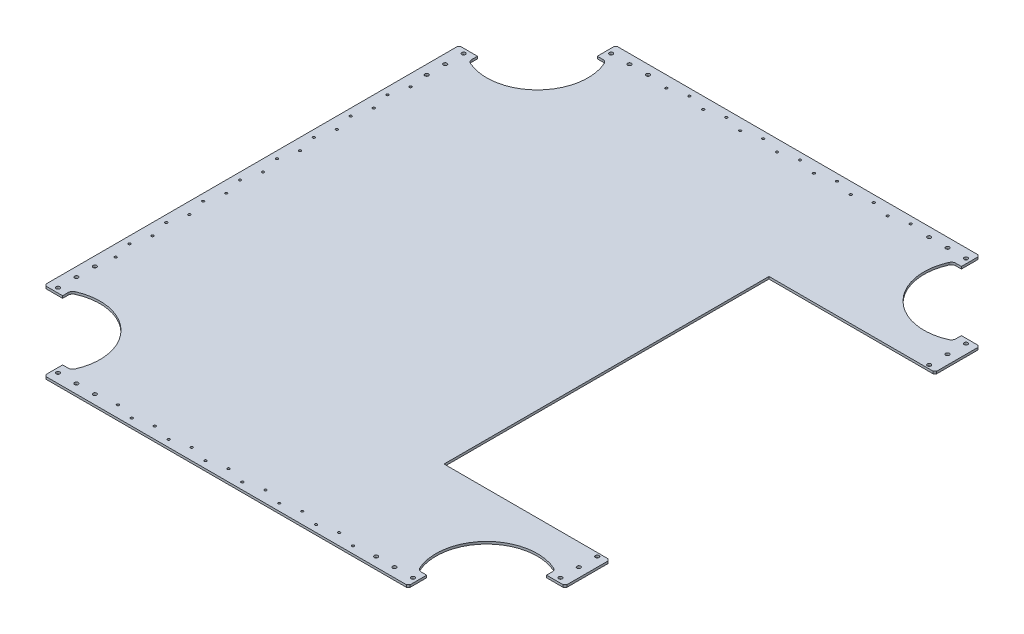
from build123d import *

# Parameters (mm, degrees)
SKETCH1_W                    = 717.55
SKETCH1_H                    = 787.4
BOSS_EXTRUDE1_DEPTH          = 3.175
SWERVE_CUTOUT_DEPTH          = 533.662436492
SKETCH2_W                    = 228.6
SKETCH2_H                    = 447.675
INTAKE_CUTOUT_DEPTH          = 3.175
F_8_0_199_DIAMETER_HOLE1_D   = 5.0546
F_30_0_1285_DIAMETER_HOLE1_D = 3.2639
FILLET1_R                    = 6.35
CHAMFER1_SIZE                = 2.54


with BuildPart() as part:
    # Sketch1 → Boss-Extrude1 (new body)
    with BuildSketch(Plane(origin=(0, 0, 0), x_dir=(1, 0, 0), z_dir=(0, 1, 0))):
        Rectangle(SKETCH1_W, SKETCH1_H)
    extrude(amount=BOSS_EXTRUDE1_DEPTH)

    # Sketch8 → Swerve Cutout (cut, through all)
    with BuildSketch(Plane(origin=(0, 3.175, 0), x_dir=(1, 0, 0), z_dir=(0, 1, 0))):
        with BuildLine():
            Line((358.775, 285.755663772), (358.775, 393.7))
            Line((358.775, 393.7), (250.830663772, 393.7))
            Line((250.830663772, 393.7), (250.830663772, 368.3))
            Line((250.830663772, 368.3), (239.222863772, 368.3))
            ThreePointArc((239.222863772, 368.3), (251.852591334, 286.777591334), (333.375, 274.147863772))
            Line((333.375, 274.147863772), (333.375, 285.755663772))
            Line((333.375, 285.755663772), (358.775, 285.755663772))
        make_face()
        with BuildLine():
            Line((333.375, -285.755663772), (333.375, -274.147863772))
            ThreePointArc((333.375, -274.147863772), (251.852591334, -286.777591334), (239.222863772, -368.3))
            Line((239.222863772, -368.3), (250.830663772, -368.3))
            Line((250.830663772, -368.3), (250.830663772, -393.7))
            Line((250.830663772, -393.7), (358.775, -393.7))
            Line((358.775, -393.7), (358.775, -285.755663772))
            Line((358.775, -285.755663772), (333.375, -285.755663772))
        make_face()
        with BuildLine():
            Line((-358.775, -285.755663772), (-358.775, -393.7))
            Line((-358.775, -393.7), (-250.830663772, -393.7))
            Line((-250.830663772, -393.7), (-250.830663772, -368.3))
            Line((-250.830663772, -368.3), (-239.222863772, -368.3))
            ThreePointArc((-239.222863772, -368.3), (-251.852591334, -286.777591334), (-333.375, -274.147863772))
            Line((-333.375, -274.147863772), (-333.375, -285.755663772))
            Line((-333.375, -285.755663772), (-358.775, -285.755663772))
        make_face()
        with BuildLine():
            Line((-333.375, 285.755663772), (-333.375, 274.147863772))
            ThreePointArc((-333.375, 274.147863772), (-251.852591334, 286.777591334), (-239.222863772, 368.3))
            Line((-239.222863772, 368.3), (-250.830663772, 368.3))
            Line((-250.830663772, 368.3), (-250.830663772, 393.7))
            Line((-250.830663772, 393.7), (-358.775, 393.7))
            Line((-358.775, 393.7), (-358.775, 285.755663772))
            Line((-358.775, 285.755663772), (-333.375, 285.755663772))
        make_face()
    extrude(amount=-SWERVE_CUTOUT_DEPTH, mode=Mode.SUBTRACT)

    # Sketch2 → Intake Cutout (cut)
    with BuildSketch(Plane(origin=(0, 3.175, 0), x_dir=(1, 0, 0), z_dir=(0, 1, 0))):
        with Locations((244.475, 0)):
            Rectangle(SKETCH2_W, SKETCH2_H)
    extrude(amount=-INTAKE_CUTOUT_DEPTH, mode=Mode.SUBTRACT)

    # #8 (0.199) Diameter Hole1 (through all)
    with Locations(Plane(origin=(0, 3.175, 0), x_dir=(1, 0, 0), z_dir=(0, 1, 0))):
        with Locations((244.480663772, 381), (219.080663772, 381), (193.680663772, 381), (346.075, 279.405663772), (346.075, 254.005663772), (346.075, 228.605663772), (346.075, -228.605663772), (346.075, -254.005663772), (346.075, -279.405663772), (193.680663772, -381), (219.080663772, -381), (244.480663772, -381), (-244.480663772, -381), (-219.080663772, -381), (-193.680663772, -381), (-346.075, -279.405663772), (-346.075, -254.005663772), (-346.075, -228.605663772), (-346.075, 228.605663772), (-346.075, 254.005663772), (-346.075, 279.405663772), (-193.680663772, 381), (-219.080663772, 381), (-244.480663772, 381)):
            Hole(F_8_0_199_DIAMETER_HOLE1_D / 2)

    # #30 (0.1285) Diameter Hole1 (through all)
    with Locations(Plane(origin=(0, 3.175, 0), x_dir=(1, 0, 0), z_dir=(0, 1, 0))):
        with Locations((-139.7, 384.175), (-114.3, 377.825), (-88.9, 384.175), (-63.5, 377.825), (-38.1, 384.175), (-12.7, 377.825), (12.7, 384.175), (38.1, 377.825), (63.5, 384.175), (88.9, 377.825), (114.3, 384.175), (139.7, 377.825), (165.1, 384.175), (-165.1, 377.825), (-165.1, -377.825), (165.1, -384.175), (139.7, -377.825), (114.3, -384.175), (88.9, -377.825), (63.5, -384.175), (38.1, -377.825), (12.7, -384.175), (-12.7, -377.825), (-38.1, -384.175), (-63.5, -377.825), (-88.9, -384.175), (-114.3, -377.825), (-139.7, -384.175), (-342.9, -203.2), (-349.25, -177.8), (-342.9, -152.4), (-349.25, -127), (-342.9, -101.6), (-349.25, -76.2), (-342.9, -50.8), (-349.25, -25.4), (-342.9, 0), (-349.25, 25.4), (-342.9, 50.8), (-349.25, 76.2), (-342.9, 101.6), (-349.25, 127), (-342.9, 152.4), (-349.25, 177.8), (-342.9, 203.2)):
            Hole(F_30_0_1285_DIAMETER_HOLE1_D / 2)

    # Fillet1
    fillet1_edges = [part.edges().sort_by_distance(p)[0] for p in [
        (239.222863772, 1.5875, 368.3),
        (333.375, 1.5875, 274.147863772),
        (-239.222863772, 1.5875, 368.3),
        (-333.375, 1.5875, 274.147863772),
        (-239.222863772, 1.5875, -368.3),
        (-333.375, 1.5875, -274.147863772),
        (239.222863772, 1.5875, -368.3),
        (333.375, 1.5875, -274.147863772),
    ]]
    fillet(fillet1_edges, radius=FILLET1_R)

    # Chamfer1
    chamfer1_edges = [part.edges().sort_by_distance(p)[0] for p in [
        (358.775, 1.5875, -223.8375),
        (358.775, 1.5875, 223.8375),
        (358.775, 1.5875, 285.755663772),
        (250.830663772, 1.5875, 393.7),
        (-250.830663772, 1.5875, 393.7),
        (-358.775, 1.5875, 285.755663772),
        (-358.775, 1.5875, -285.755663772),
        (-250.830663772, 1.5875, -393.7),
        (250.830663772, 1.5875, -393.7),
        (358.775, 1.5875, -285.755663772),
    ]]
    chamfer(chamfer1_edges, length=CHAMFER1_SIZE)


solid = part.part
